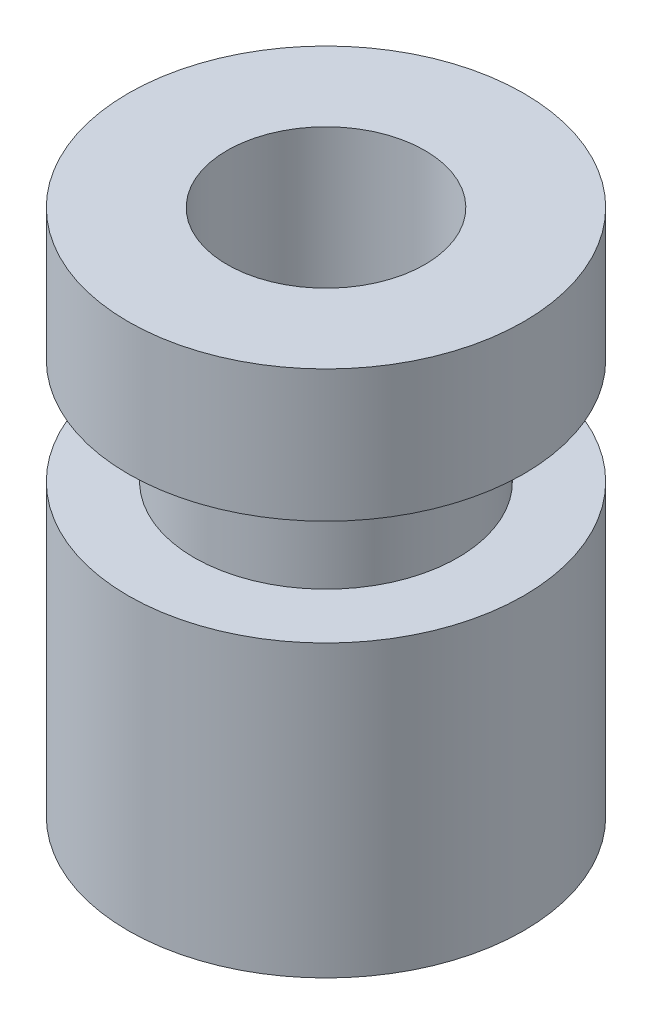
from build123d import *


with BuildPart() as part:
    # Sketch1 → Revolve1 (revolve)
    with BuildSketch(Plane.XY, mode=Mode.PRIVATE) as revolve1_sk:
        Polygon((1.5, 8), (3, 8), (3, 6), (2, 6), (2, 4.4), (3, 4.4), (3, 0), (1.5, 0), align=None)
    revolve(revolve1_sk.sketch.rotate(Axis((0, 0, 0), (0, 1, 0)), 90), axis=Axis((0, 0, 0), (0, 1, 0)))


solid = part.part
